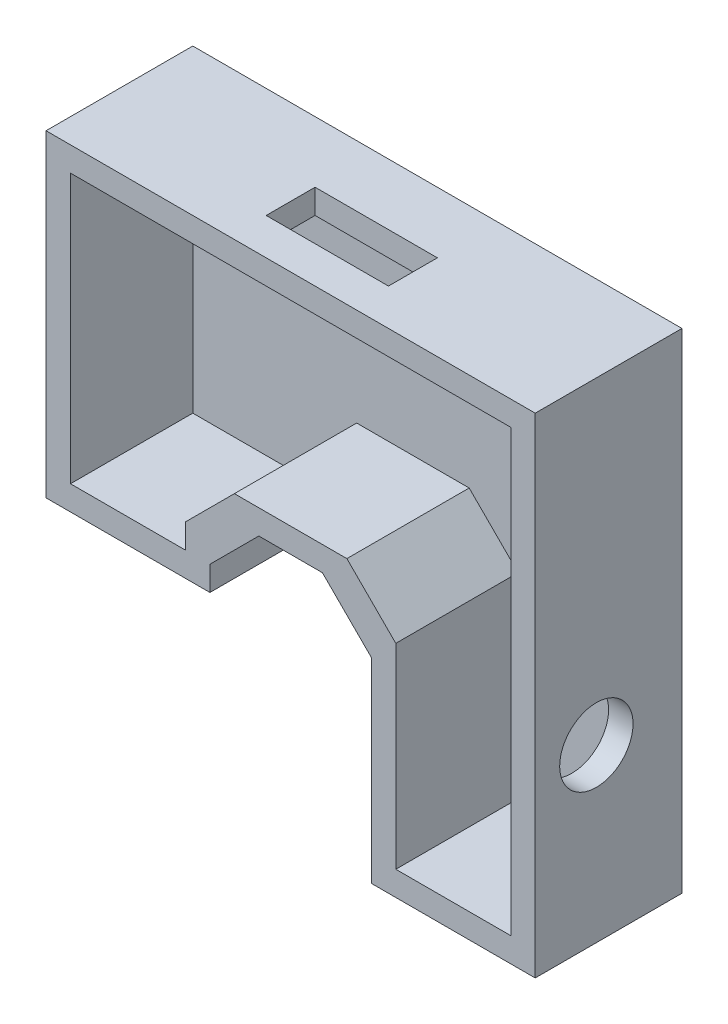
from build123d import *

# Parameters (mm, degrees)
BOSS_EXTRUDE1_DEPTH = 12.5
BOSS_EXTRUDE2_DEPTH = 5
SKETCH3_W           = 25
SKETCH3_H           = 10
CUT_EXTRUDE1_DEPTH  = 109.771549589
SKETCH4_R           = 7.5
CUT_EXTRUDE2_DEPTH  = 10
CHAMFER2_SIZE       = 10
CHAMFER3_SIZE       = 10


with BuildPart() as part:
    # Sketch1 → Boss-Extrude1 (new, symmetric)
    with BuildSketch(Plane.XY):
        Polygon((50, -50), (16.5, -50), (16.5, -45), (16.5, 0), (-16.5, 0), (-16.5, -15), (-50, -15), (-50, 50), (50, 50), align=None)
        Polygon((45, -45), (45, 45), (-45, 45), (-45, -10), (-21.5, -10), (-21.5, 5), (21.5, 5), (21.5, -45), align=None, mode=Mode.SUBTRACT)
    extrude(amount=BOSS_EXTRUDE1_DEPTH, both=True)

    # Sketch2 → Boss-Extrude2 (add)
    with BuildSketch(Plane(origin=(0, 0, -12.5), x_dir=(-1, 0, 0), z_dir=(0, 0, -1))):
        Polygon((-16.5, 0), (16.5, 0), (16.5, -15), (50, -15), (50, 50), (-50, 50), (-50, -50), (-16.5, -50), align=None)
    extrude(amount=BOSS_EXTRUDE2_DEPTH)

    # Sketch3 → Cut-Extrude1 (cut, through all)
    with BuildSketch(Plane.XZ.offset(-45)):
        Rectangle(SKETCH3_W, SKETCH3_H)
    extrude(amount=-CUT_EXTRUDE1_DEPTH, mode=Mode.SUBTRACT)

    # Sketch4 → Cut-Extrude2 (cut)
    with BuildSketch(Plane(origin=(50, 0, 0), x_dir=(0, 0, -1), z_dir=(1, 0, 0))):
        with Locations(Location((0, -15, 0), (0, 0, 90))):
            Circle(SKETCH4_R)
    extrude(amount=-CUT_EXTRUDE2_DEPTH, mode=Mode.SUBTRACT)

    # Chamfer2
    chamfer2_edges = [part.edges().sort_by_distance(p)[0] for p in [
        (16.5, 0, -2.5),
        (-16.5, 0, -2.5),
    ]]
    chamfer(chamfer2_edges, length=CHAMFER2_SIZE)

    # Chamfer3
    chamfer3_edges = [part.edges().sort_by_distance(p)[0] for p in [
        (-21.5, 5, 0),
        (21.5, 5, 0),
    ]]
    chamfer(chamfer3_edges, length=CHAMFER3_SIZE)


solid = part.part
